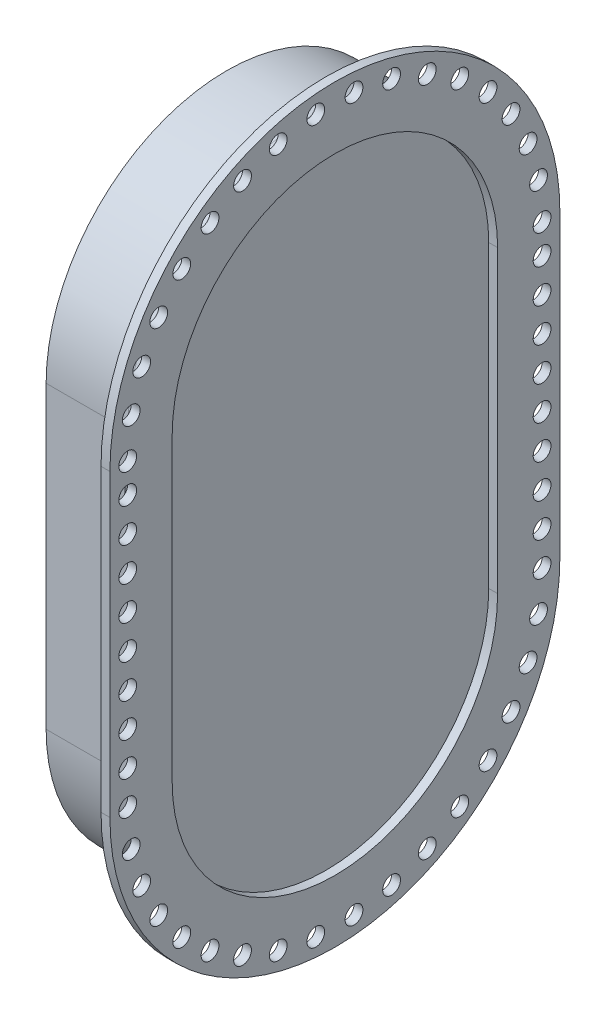
from build123d import *

# Parameters (mm, degrees)
BOSS_EXTRUDE1_DEPTH = 60.869805
BOSS_EXTRUDE2_START = -5
BOSS_EXTRUDE2_DEPTH = 5
FILLET1_R           = 10
SKETCH3_R           = 4.999999999999958
SKETCH3_R_2         = 4.999999999999997
SKETCH3_R_3         = 4.999999999999978
SKETCH3_R_4         = 4.999999999999986
SKETCH3_R_5         = 4.999999999999999
SKETCH3_R_6         = 5.0000000000000036
SKETCH3_R_7         = 4.999999999999983
SKETCH3_R_8         = 4.999999999999977
SKETCH3_R_9         = 5.000000000000012
SKETCH3_R_10        = 4.999999999999975
SKETCH3_R_11        = 4.9999999999999885
SKETCH3_R_12        = 4.999999999999973
SKETCH3_R_13        = 4.999999999999992
SKETCH3_R_14        = 4.999999999999971
SKETCH3_R_15        = 4.999999999999981
SKETCH3_R_16        = 4.999999999999987
SKETCH3_R_17        = 5.000000000001771
SKETCH3_R_18        = 4.9999999999999964
SKETCH3_R_19        = 4.999999999999843
SKETCH3_R_20        = 4.999999999999972
SKETCH3_R_21        = 5.000000000000026
SKETCH3_R_22        = 5.000000000000054
SKETCH3_R_23        = 5.000000000000019
SKETCH3_R_24        = 5.000000000000072
SKETCH3_R_25        = 4.999999999999844
SKETCH3_R_26        = 4.99999999999993
SKETCH3_R_27        = 5.000000000000166
SKETCH3_R_28        = 4.999999999999691
SKETCH3_R_29        = 5.000000000000506
SKETCH3_R_30        = 4.999999999999985
SKETCH3_R_31        = 4.999999999999989
SKETCH3_R_32        = 5.00000000000002
SKETCH3_R_33        = 4.999999999999994
SKETCH3_R_34        = 5.000000000000028
SKETCH3_R_35        = 4.99999999999996
SKETCH3_R_36        = 5.000000000000008
SKETCH3_R_37        = 5.000000000000001
SKETCH3_R_38        = 5.000000000000018
SKETCH3_R_39        = 5.000000000000002
SKETCH3_R_40        = 4.99999999999998
CUT_EXTRUDE1_DEPTH  = 5


with BuildPart() as part:
    # Sketch1 → Boss-Extrude1 (new body)
    with BuildSketch(Plane(origin=(0, 0, 0), x_dir=(0, 0, -1), z_dir=(1, 0, 0))):
        with BuildLine():
            Line((-101.5, -73.52493948763251), (-101.5, 94.95731051236748))
            ThreePointArc((-101.5, 94.95731051236748), (2.875e-14, 196.45731051236748), (101.5, 94.95731051236748))
            Line((101.5, 94.95731051236748), (101.5, -73.52493948763251))
            ThreePointArc((101.5, -73.52493948763251), (-1.865e-14, -175.0249394876325), (-101.5, -73.52493948763251))
        make_face()
        with BuildLine():
            Line((-91.5, -73.52493948763251), (-91.5, 94.95731051236748))
            ThreePointArc((-91.5, 94.95731051236748), (2.592e-14, 186.45731051236748), (91.5, 94.95731051236748))
            Line((91.5, 94.95731051236748), (91.5, -73.52493948763251))
            ThreePointArc((91.5, -73.52493948763251), (-1.681e-14, -165.0249394876325), (-91.5, -73.52493948763251))
        make_face(mode=Mode.SUBTRACT)
    extrude(amount=BOSS_EXTRUDE1_DEPTH)

    # Sketch2 → Boss-Extrude2 (add)
    with BuildSketch(Plane(origin=(60.869805, 0, 0), x_dir=(0, 0, -1), z_dir=(1, 0, 0)).offset(BOSS_EXTRUDE2_START)):
        with BuildLine():
            Line((-126.5, 94.95731051236748), (-126.5, -73.52493948763251))
            ThreePointArc((-126.5, -73.52493948763251), (-2.324e-14, -200.0249394876325), (126.5, -73.52493948763254))
            Line((126.5, -73.52493948763254), (126.5, 94.95731051236748))
            ThreePointArc((126.5, 94.95731051236748), (3.583e-14, 221.45731051236748), (-126.5, 94.95731051236748))
        make_face()
        with BuildLine():
            Line((101.5, -73.52493948763251), (101.5, 94.9573105123675))
            ThreePointArc((101.5, 94.9573105123675), (6.22e-15, 196.45731051236748), (-101.5, 94.95731051236751))
            Line((-101.5, 94.95731051236751), (-101.5, -73.52493948763251))
            ThreePointArc((-101.5, -73.52493948763251), (-1.865e-14, -175.0249394876325), (101.5, -73.52493948763251))
        make_face(mode=Mode.SUBTRACT)
    extrude(amount=BOSS_EXTRUDE2_DEPTH)

    # Fillet1
    fillet1_edges = [part.edges().sort_by_distance(p)[0] for p in [
        (55.869805, 10.716185512367502, 101.5),
        (55.869805, -175.0249394876325, 6.22e-15),
        (55.869805, 10.716185512367502, -101.5),
        (55.869805, 196.45731051236746, -3.12e-14),
    ]]
    fillet(fillet1_edges, radius=FILLET1_R)

    # Sketch3 → Cut-Extrude1 (cut)
    with BuildSketch(Plane.ZY.offset(-55.869805)):
        with Locations((116.50000000000001, -73.52493948763254)):
            Circle(SKETCH3_R)
        with Locations((116.49999999999991, -54.5249394876325)):
            Circle(SKETCH3_R_2)
        with Locations((114.51636611317501, -94.931758313259)):
            Circle(SKETCH3_R_3)
        with Locations((116.49999999999986, -35.52493948763251)):
            Circle(SKETCH3_R_4)
        with Locations((108.6330147256083, -115.60959359843197)):
            Circle(SKETCH3_R_5)
        with Locations((116.4999999999998, -16.52493948763251)):
            Circle(SKETCH3_R_4)
        with Locations((99.05029631250127, -134.85428646284086)):
            Circle(SKETCH3_R_6)
        with Locations((116.49999999999973, 2.475060512367487)):
            Circle(SKETCH3_R_7)
        with Locations((86.09453885620829, -152.0104819724531)):
            Circle(SKETCH3_R_8)
        with Locations((116.49999999999966, 21.475060512367484)):
            Circle(SKETCH3_R_7)
        with Locations((70.20693513818516, -166.4939464657774)):
            Circle(SKETCH3_R_9)
        with Locations((116.4999999999996, 40.47506051236748)):
            Circle(SKETCH3_R_10)
        with Locations((51.92851844796862, -177.8114629304947)):
            Circle(SKETCH3_R_11)
        with Locations((116.49999999999955, 59.47506051236749)):
            Circle(SKETCH3_R_12)
        with Locations((31.88173834339966, -185.57762691726376)):
            Circle(SKETCH3_R_13)
        with Locations((116.49999999999947, 78.47506051236748)):
            Circle(SKETCH3_R_14)
        with Locations((10.749263877476684, -189.52797102600218)):
            Circle(SKETCH3_R_15)
        with Locations((116.5, 94.95731051236747)):
            Circle(SKETCH3_R_16)
        with Locations((-10.74926387747449, -189.52797102600255)):
            Circle(SKETCH3_R_17)
        with Locations((114.51636611317436, 116.36412933800038)):
            Circle(SKETCH3_R_18)
        with Locations((-31.88173834339559, -185.57762691726487)):
            Circle(SKETCH3_R_19)
        with Locations((108.63301472560718, 137.04196462317321)):
            Circle(SKETCH3_R_7)
        with Locations((-51.92851844796495, -177.81146293049648)):
            Circle(SKETCH3_R_20)
        with Locations((99.05029631249955, 156.28665748758178)):
            Circle(SKETCH3_R_21)
        with Locations((-70.20693513818196, -166.49394646577989)):
            Circle(SKETCH3_R_22)
        with Locations((86.09453885620606, 173.44285299719374)):
            Circle(SKETCH3_R_23)
        with Locations((-86.09453885620559, -152.01048197245612)):
            Circle(SKETCH3_R_24)
        with Locations((70.20693513818269, 187.92631749051756)):
            Circle(SKETCH3_R_25)
        with Locations((-99.05029631249904, -134.85428646284436)):
            Circle(SKETCH3_R_26)
        with Locations((51.92851844796559, 199.24383395523438)):
            Circle(SKETCH3_R_27)
        with Locations((-108.63301472560683, -115.60959359843577)):
            Circle(SKETCH3_R_14)
        with Locations((31.88173834339691, 207.0099979420027)):
            Circle(SKETCH3_R_28)
        with Locations((-114.51636611317423, -94.93175831326297)):
            Circle(SKETCH3_R_7)
        with Locations((10.749263877472986, 210.96034205074073)):
            Circle(SKETCH3_R_29)
        with Locations((-116.5, -73.52493948763251)):
            Circle(SKETCH3_R_30)
        with Locations((-10.74926387747589, 210.96034205074054)):
            Circle(SKETCH3_R_2)
        with Locations((-116.50000000000006, -54.5249394876325)):
            Circle(SKETCH3_R_31)
        with Locations((-31.881738343398844, 207.0099979420022)):
            Circle(SKETCH3_R_32)
        with Locations((-116.50000000000014, -35.52493948763251)):
            Circle(SKETCH3_R_33)
        with Locations((-51.92851844796793, 199.24383395523336)):
            Circle(SKETCH3_R_34)
        with Locations((-116.50000000000016, -16.52493948763253)):
            Circle(SKETCH3_R_35)
        with Locations((-70.20693513818448, 187.9263174905162)):
            Circle(SKETCH3_R_14)
        with Locations((-116.50000000000026, 2.4750605123674947)):
            Circle(SKETCH3_R_16)
        with Locations((-86.09453885620772, 173.44285299719198)):
            Circle(SKETCH3_R_36)
        with Locations((-116.50000000000033, 21.47506051236749)):
            Circle(SKETCH3_R_16)
        with Locations((-99.05029631250082, 156.28665748757987)):
            Circle(SKETCH3_R_37)
        with Locations((-116.50000000000041, 40.47506051236749)):
            Circle(SKETCH3_R_2)
        with Locations((-108.63301472560802, 137.04196462317103)):
            Circle(SKETCH3_R_38)
        with Locations((-116.50000000000045, 59.475060512367506)):
            Circle(SKETCH3_R_31)
        with Locations((-114.51636611317484, 116.36412933799802)):
            Circle(SKETCH3_R_39)
        with Locations((-116.50000000000051, 78.47506051236749)):
            Circle(SKETCH3_R_40)
        with Locations((-116.49999999999997, 94.9573105123675)):
            Circle(SKETCH3_R_16)
    extrude(amount=-CUT_EXTRUDE1_DEPTH, mode=Mode.SUBTRACT)


solid = part.part
